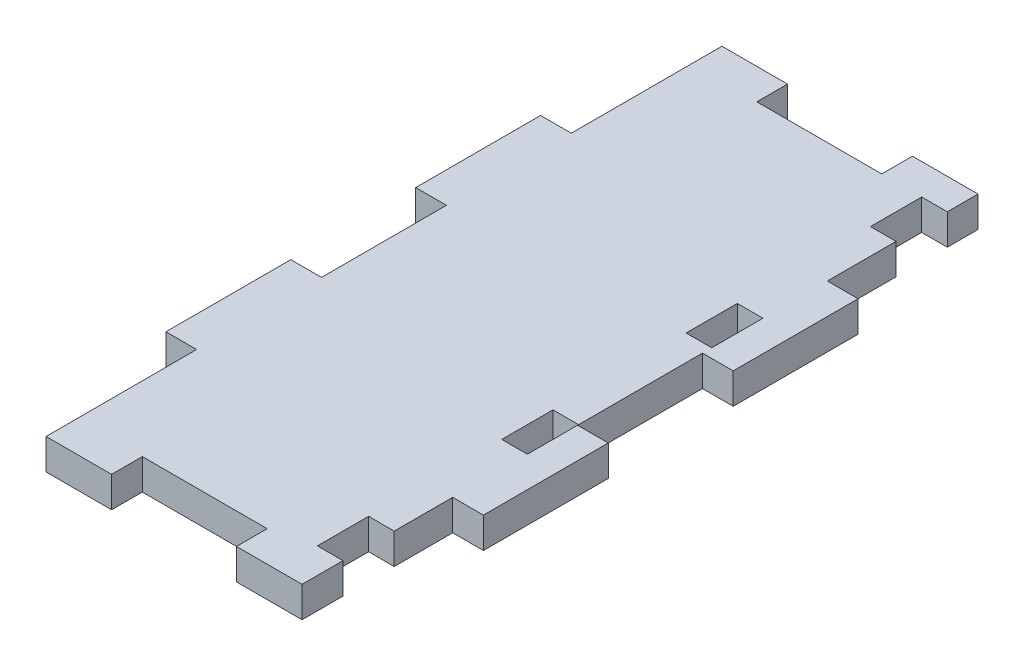
from build123d import *

# Parameters (mm, degrees)
BOSS_EXTRUDE1_DEPTH = 6
SKETCH3_W           = 5
SKETCH3_H           = 10
CUT_EXTRUDE2_DEPTH  = 10


with BuildPart() as part:
    # Sketch2 → Boss-Extrude1 (new body)
    with BuildSketch(Plane(origin=(0, 0, 0), x_dir=(1, 0, 0), z_dir=(0, 1, 0))):
        Polygon((121, 270), (121, 240.585), (115, 240.585), (115, 216.195), (121, 216.195), (121, 191.805), (115, 191.805), (115, 167.415), (121, 167.415), (121, 143.025), (121, 138), (133.805, 138), (133.805, 144), (158.195, 144), (158.195, 138), (171, 138), (171, 167.415), (177, 167.415), (177, 191.805), (171, 191.805), (171, 216.195), (177, 216.195), (177, 240.585), (171, 240.585), (171, 264.975), (171, 270), (158.195, 270), (158.195, 264), (133.805, 264), (133.805, 270), align=None)
    extrude(amount=BOSS_EXTRUDE1_DEPTH)

    # Sketch3 → Cut-Extrude2 (cut)
    with BuildSketch(Plane(origin=(0, 6, 0), x_dir=(1, 0, 0), z_dir=(0, 1, 0))):
        with Locations((168.5, 259)):
            Rectangle(SKETCH3_W, SKETCH3_H)
        with Locations((168.5, 223)):
            Rectangle(SKETCH3_W, SKETCH3_H)
        with Locations((168.5, 187)):
            Rectangle(SKETCH3_W, SKETCH3_H)
        with Locations((168.5, 151)):
            Rectangle(SKETCH3_W, SKETCH3_H)
    extrude(amount=-CUT_EXTRUDE2_DEPTH, mode=Mode.SUBTRACT)


solid = part.part
